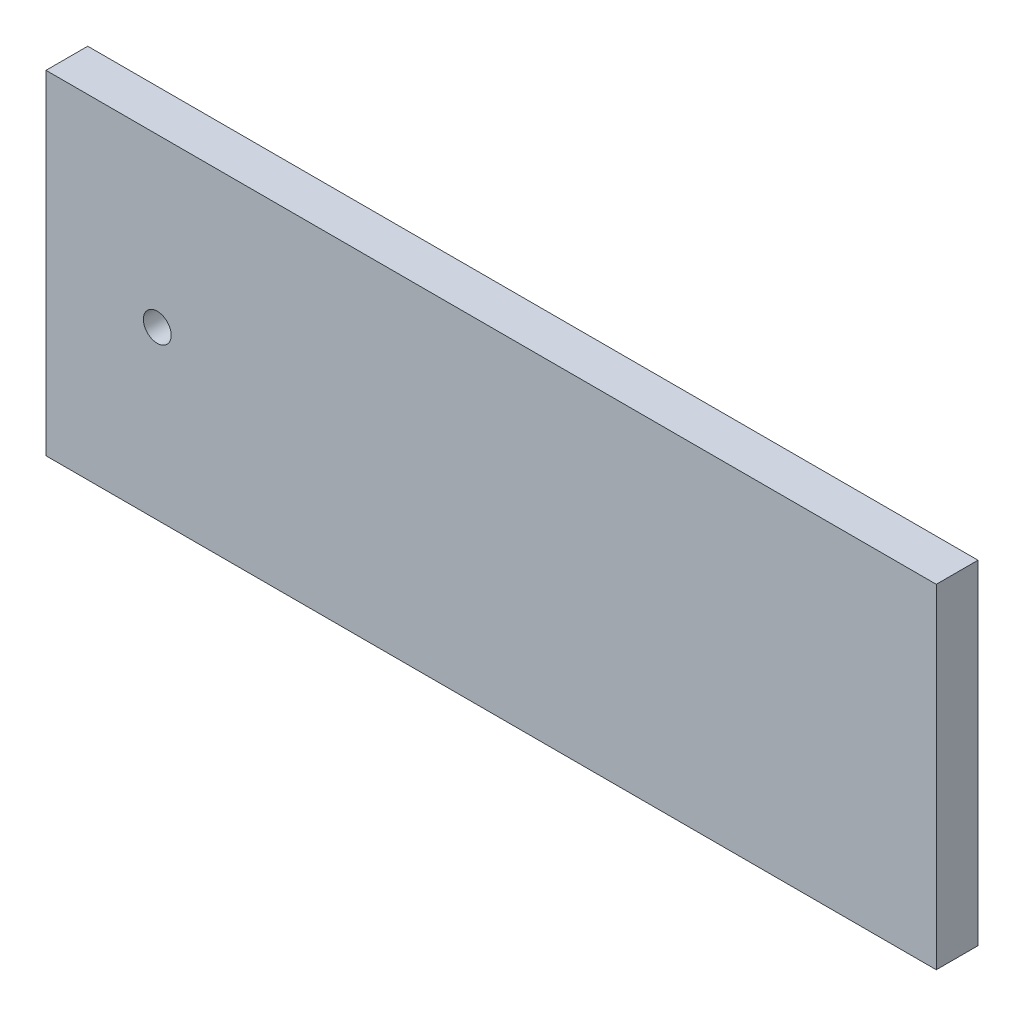
from build123d import *

# Parameters (mm, degrees)
SKETCH1_W       = 203.2
SKETCH1_H       = 76.2
PLATE_DEPTH     = 9.525
SKETCH2_R       = 3.175
SEED_HOLE_DEPTH = 218.226622735


with BuildPart() as part:
    # Sketch1 → plate (new body)
    with BuildSketch(Plane.XY):
        with Locations((101.6, 38.1)):
            Rectangle(SKETCH1_W, SKETCH1_H)
    extrude(amount=PLATE_DEPTH)

    # Sketch2 → seed_hole (cut, through all)
    with BuildSketch(Plane.XY):
        with Locations((25.4, 38.1)):
            Circle(SKETCH2_R)
    extrude(amount=SEED_HOLE_DEPTH, mode=Mode.SUBTRACT)


solid = part.part
